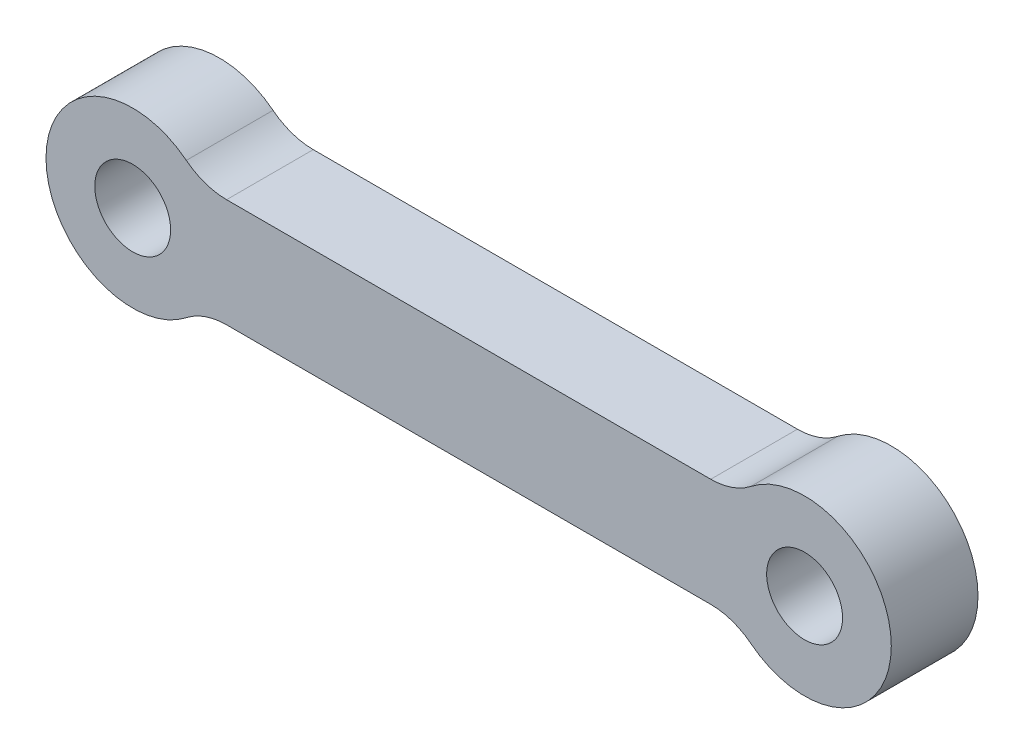
from build123d import *

# Parameters (mm, degrees)
SKETCH1_R           = 4
SKETCH1_R_2         = 1.75
BOSS_EXTRUDE1_DEPTH = 2
FILLET1_R           = 3


with BuildPart() as part:
    # Sketch1 → Boss-Extrude1 (new, symmetric)
    # profile 1 of 3: a face of its own
    with BuildSketch(Plane.XY):
        with BuildLine():
            ThreePointArc((-11.5, 0), (-11.725745372, -1.324764885), (-12.377501001, -2.5))
            Line((-12.377501001, -2.5), (12.377501001, -2.5))
            ThreePointArc((12.377501001, -2.5), (11.5, 0), (12.377501001, 2.5))
            Line((12.377501001, 2.5), (-12.377501001, 2.5))
            ThreePointArc((-12.377501001, 2.5), (-11.725745372, 1.324764885), (-11.5, 0))
        make_face()
    # profile 2 of 3: a face of its own
    with BuildSketch(Plane.XY):
        with Locations((-15.5, 0)):
            Circle(SKETCH1_R)
        with Locations((-15.5, 0)):
            Circle(SKETCH1_R_2, mode=Mode.SUBTRACT)
    # profile 3 of 3: a face of its own
    with BuildSketch(Plane.XY):
        with Locations((15.5, 0)):
            Circle(SKETCH1_R)
        with Locations((15.5, 0)):
            Circle(SKETCH1_R_2, mode=Mode.SUBTRACT)
    extrude(amount=BOSS_EXTRUDE1_DEPTH, both=True)

    # Fillet1
    fillet1_edges = [part.edges().sort_by_distance(p)[0] for p in [
        (-12.377501001, -2.5, 0),
        (-12.377501001, 2.5, 0),
        (12.377501001, 2.5, 0),
        (12.377501001, -2.5, 0),
    ]]
    fillet(fillet1_edges, radius=FILLET1_R)


solid = part.part
